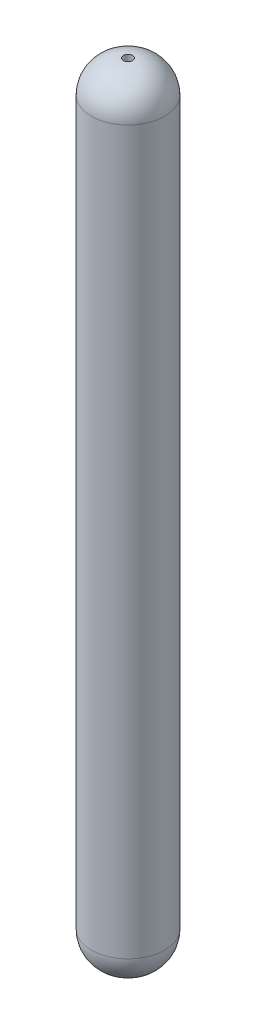
from build123d import *


with BuildPart() as part:
    # Sketch1 → Revolve1 (revolve)
    with BuildSketch(Plane.XY, mode=Mode.PRIVATE) as revolve1_sk:
        with BuildLine():
            Line((6.35, -544.45), (6.35, 544.45))
            ThreePointArc((6.35, 544.45), (37.780896424, 531.430896424), (50.8, 500))
            Line((50.8, 500), (50.8, -500))
            ThreePointArc((50.8, -500), (37.780896424, -531.430896424), (6.35, -544.45))
        make_face()
    revolve(revolve1_sk.sketch.rotate(Axis((0, -7.11525337, 0), (0, 1, 0)), 90), axis=Axis((0, -7.11525337, 0), (0, 1, 0)))


solid = part.part
